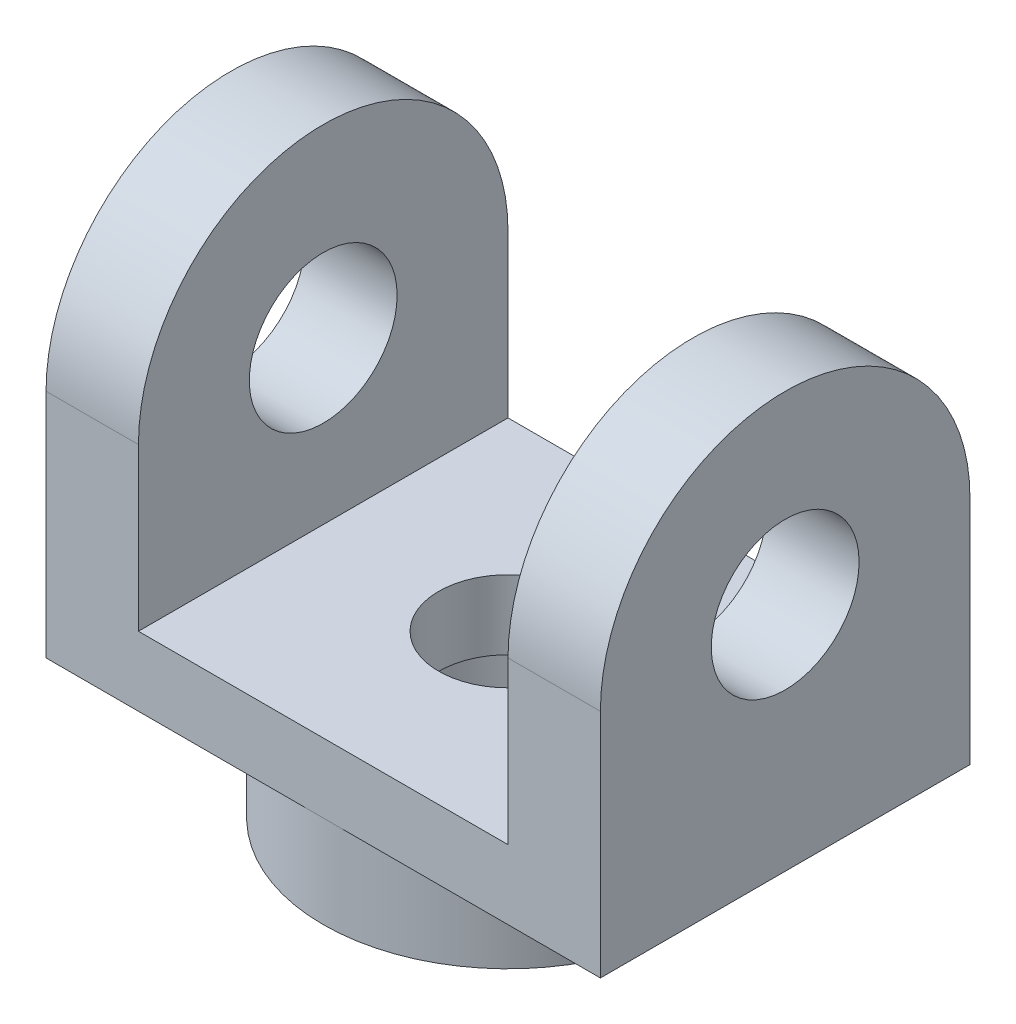
from build123d import *

# Parameters (mm, degrees)
SKETCH1_R           = 40
SKETCH1_R_2         = 30
BOSS_EXTRUDE2_DEPTH = 20
SKETCH2_W           = 120
SKETCH2_H           = 80
BOSS_EXTRUDE3_DEPTH = 15
SKETCH3_R           = 15
CUT_EXTRUDE1_DEPTH  = 37
SKETCH7_W           = 20
SKETCH7_H           = 35
BOSS_EXTRUDE5_DEPTH = 80
BOSS_EXTRUDE6_DEPTH = 20
SKETCH9_R           = 16
CUT_EXTRUDE2_DEPTH  = 20


with BuildPart() as part:
    # Sketch1 → Boss-Extrude2 (new body)
    with BuildSketch(Plane(origin=(0, 0, 0), x_dir=(1, 0, 0), z_dir=(0, 1, 0))):
        with Locations(Location((0, 0, 0), (0, 0, 270))):
            Circle(SKETCH1_R)
        with Locations(Location((0, 0, 0), (0, 0, 270))):
            Circle(SKETCH1_R_2, mode=Mode.SUBTRACT)
    extrude(amount=BOSS_EXTRUDE2_DEPTH)

    # Sketch2 → Boss-Extrude3 (add)
    with BuildSketch(Plane(origin=(0, 20, 0), x_dir=(1, 0, 0), z_dir=(0, 1, 0))):
        Rectangle(SKETCH2_W, SKETCH2_H)
    extrude(amount=BOSS_EXTRUDE3_DEPTH)

    # Sketch3 → Cut-Extrude1 (cut)
    with BuildSketch(Plane.XZ.offset(-20)):
        with Locations(Location((0, 0, 0), (0, 0, 270))):
            Circle(SKETCH3_R)
    extrude(amount=-CUT_EXTRUDE1_DEPTH, mode=Mode.SUBTRACT)

    # Sketch7 → Boss-Extrude5 (add)
    with BuildSketch(Plane.XY.offset(40)):
        with Locations((50, 52.5)):
            Rectangle(SKETCH7_W, SKETCH7_H)
    boss_extrude5 = extrude(amount=-BOSS_EXTRUDE5_DEPTH)

    # Sketch8 → Boss-Extrude6 (add)
    with BuildSketch(Plane.ZY.offset(-40)):
        with BuildLine():
            Line((40, 70), (-40, 70))
            ThreePointArc((-40, 70), (0, 110), (40, 70))
        make_face()
    boss_extrude6 = extrude(amount=-BOSS_EXTRUDE6_DEPTH)

    # Sketch9 → Cut-Extrude2 (cut)
    with BuildSketch(Plane(origin=(60, 0, 0), x_dir=(0, 0, -1), z_dir=(1, 0, 0))):
        with Locations((0, 70)):
            Circle(SKETCH9_R)
    cut_extrude2 = extrude(amount=-CUT_EXTRUDE2_DEPTH, mode=Mode.SUBTRACT)

    # Mirror1: Boss-Extrude5, Boss-Extrude6, Cut-Extrude2 across plane
    add(boss_extrude5.mirror(Plane(origin=(0, 0, 0), x_dir=(0, 0, 1), z_dir=(1, 0, 0))))
    add(boss_extrude6.mirror(Plane(origin=(0, 0, 0), x_dir=(0, 0, 1), z_dir=(1, 0, 0))))
    add(cut_extrude2.mirror(Plane(origin=(0, 0, 0), x_dir=(0, 0, 1), z_dir=(1, 0, 0))), mode=Mode.SUBTRACT)


solid = part.part
